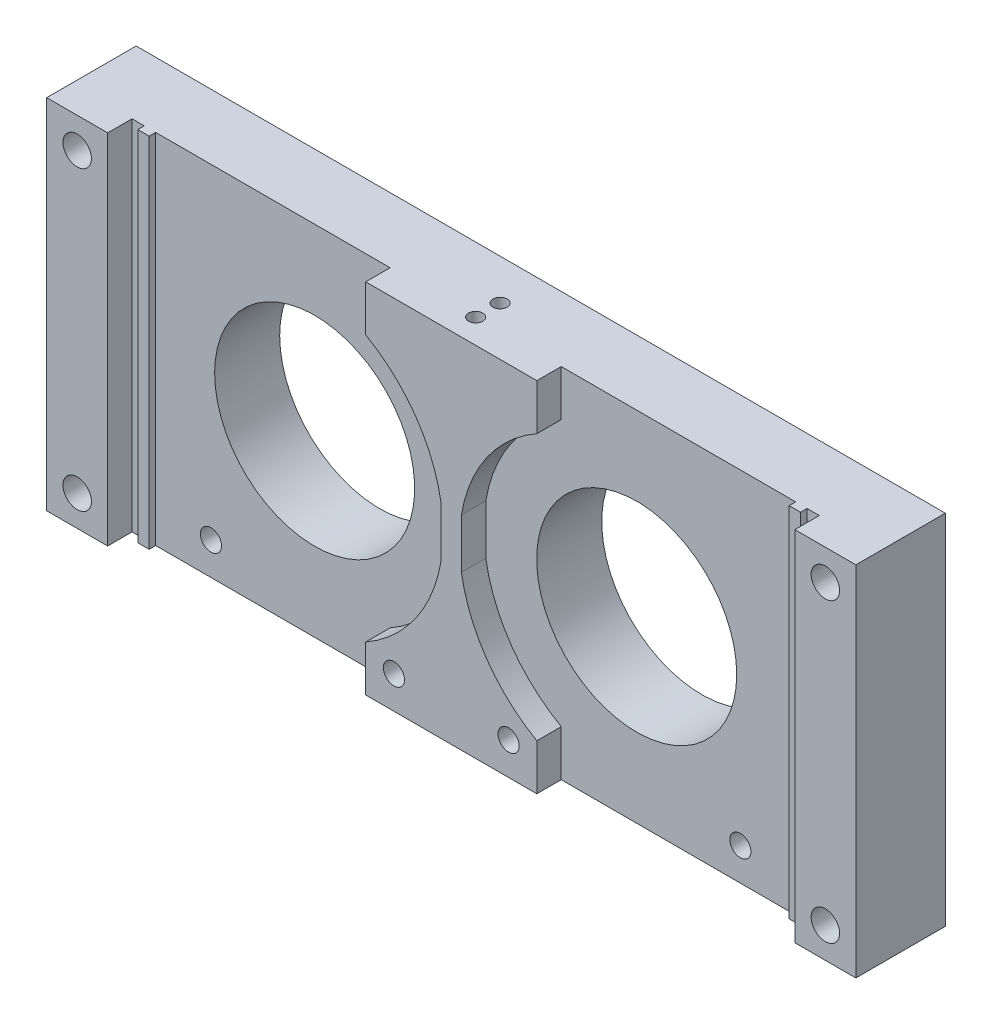
from build123d import *

# Parameters (mm, degrees)
SKETCH1_W                               = 99.5
SKETCH1_H                               = 44
BOSS_EXTRUDE1_DEPTH                     = 6
SKETCH5_R                               = 12.3
CUT_EXTRUDE1_DEPTH                      = 6
SKETCH5_5_R                             = 12.3
CUT_EXTRUDE4_DEPTH                      = 6
SKETCH2_R                               = 1.75
CUT_EXTRUDE8_DEPTH                      = 6
BOSS_EXTRUDE5_START                     = 3
SKETCH2_15_W                            = 7.5
SKETCH2_15_H                            = 44
SKETCH2_15_R                            = 1.75
BOSS_EXTRUDE5_DEPTH                     = 3
BOSS_EXTRUDE6_DEPTH                     = 3
SKETCH8_W                               = 1.4
SKETCH8_H                               = 44
BOSS_EXTRUDE7_DEPTH                     = 0.8
MOVE_FACE3_BY                           = 2
SKETCH9_W                               = 1.4
SKETCH9_H                               = 44
BOSS_EXTRUDE8_DEPTH                     = 0.8
SKETCH12_R                              = 0.875
CUT_EXTRUDE13_DEPTH                     = 44
SKETCH14_R                              = 1.3
CUT_EXTRUDE15_DEPTH                     = 6.5
SKETCH15_R                              = 1.6
CUT_EXTRUDE17_DEPTH                     = 4
SKETCH17_R                              = 1.3
CUT_EXTRUDE18_DEPTH                     = 5.8
SKETCH18_R                              = 1.6
CUT_EXTRUDE19_DEPTH                     = 4
CBORE_FOR_M5_HEX_HEAD_BOLT1_D           = 2.6
CBORE_FOR_M5_HEX_HEAD_BOLT1_CBORE_D     = 3.2
CBORE_FOR_M5_HEX_HEAD_BOLT1_CBORE_DEPTH = 4


with BuildPart() as part:
    # Sketch1 → Boss-Extrude1 (new body)
    with BuildSketch(Plane.XY):
        with Locations((12.809190031, 1.12305296)):
            Rectangle(SKETCH1_W, SKETCH1_H)
    extrude(amount=BOSS_EXTRUDE1_DEPTH)

    # Sketch5 → Cut-Extrude1 (cut)
    with BuildSketch(Plane(origin=(0, 0, 0), x_dir=(-1, 0, 0), z_dir=(0, 0, -1))):
        with Locations((-32.609190031, 1.12305296)):
            Circle(SKETCH5_R)
    extrude(amount=-CUT_EXTRUDE1_DEPTH, mode=Mode.SUBTRACT)

    # Sketch5<5> → Cut-Extrude4 (cut)
    with BuildSketch(Plane(origin=(0, 0, 0), x_dir=(-1, 0, 0), z_dir=(0, 0, -1))):
        with Locations((6.990809969, 1.12305296)):
            Circle(SKETCH5_5_R)
        with Locations((-32.609190031, 1.12305296)):
            Circle(SKETCH5_5_R)
    extrude(amount=-CUT_EXTRUDE4_DEPTH, mode=Mode.SUBTRACT)

    # Sketch2 → Cut-Extrude8 (cut)
    with BuildSketch(Plane.XY.offset(6)):
        with Locations((-33.190809969, 19.37305296)):
            Circle(SKETCH2_R)
        with Locations((58.809190031, 19.37305296)):
            Circle(SKETCH2_R)
        with Locations((58.809190031, -17.12694704)):
            Circle(SKETCH2_R)
        with Locations((-33.190809969, -17.12694704)):
            Circle(SKETCH2_R)
    extrude(amount=-CUT_EXTRUDE8_DEPTH, mode=Mode.SUBTRACT)

    # Sketch2<15> → Boss-Extrude5 (add)
    # profile 1 of 2: a face of its own
    with BuildSketch(Plane.XY.offset(6).offset(BOSS_EXTRUDE5_START)):
        with Locations((-33.190809969, 1.12305296)):
            Rectangle(SKETCH2_15_W, SKETCH2_15_H)
        with Locations((-33.190809969, 19.37305296)):
            Circle(SKETCH2_15_R, mode=Mode.SUBTRACT)
        with Locations((-33.190809969, -17.12694704)):
            Circle(SKETCH2_15_R, mode=Mode.SUBTRACT)
    # profile 2 of 2: a face of its own
    with BuildSketch(Plane.XY.offset(6).offset(BOSS_EXTRUDE5_START)):
        with Locations((58.809190031, 1.12305296)):
            Rectangle(SKETCH2_15_W, SKETCH2_15_H)
        with Locations((58.809190031, 19.37305296)):
            Circle(SKETCH2_15_R, mode=Mode.SUBTRACT)
        with Locations((58.809190031, -17.12694704)):
            Circle(SKETCH2_15_R, mode=Mode.SUBTRACT)
    extrude(amount=-BOSS_EXTRUDE5_DEPTH)

    # Sketch6 → Boss-Extrude6 (add)
    with BuildSketch(Plane.XY.offset(6)):
        with BuildLine():
            Line((11.559190031, -20.87694704), (14.059190031, -20.87694704))
            Line((14.059190031, -20.87694704), (23.329238523, -20.87694704))
            Line((23.329238523, -20.87694704), (23.329238523, -15.22694704))
            ThreePointArc((23.329238523, -15.22694704), (17.186408911, -9.627659693), (14.058246659, -1.92694704))
            Line((14.058246659, -1.92694704), (14.058246659, 4.17305296))
            ThreePointArc((14.058246659, 4.17305296), (17.186408911, 11.873765612), (23.329238523, 17.47305296))
            Line((23.329238523, 17.47305296), (23.329238523, 23.12305296))
            Line((23.329238523, 23.12305296), (14.059190031, 23.12305296))
            Line((14.059190031, 23.12305296), (11.559190031, 23.12305296))
            Line((11.559190031, 23.12305296), (2.28914154, 23.12305296))
            Line((2.28914154, 23.12305296), (2.28914154, 17.47305296))
            ThreePointArc((2.28914154, 17.47305296), (8.431971151, 11.873765612), (11.560133403, 4.17305296))
            Line((11.560133403, 4.17305296), (11.560133403, -1.92694704))
            ThreePointArc((11.560133403, -1.92694704), (8.431971151, -9.627659693), (2.28914154, -15.22694704))
            Line((2.28914154, -15.22694704), (2.28914154, -20.87694704))
            Line((2.28914154, -20.87694704), (11.559190031, -20.87694704))
        make_face()
    extrude(amount=BOSS_EXTRUDE6_DEPTH)

    # Sketch8 → Boss-Extrude7 (add)
    with BuildSketch(Plane.XY.offset(6)):
        with Locations((-27.240809969, 1.12305296)):
            Rectangle(SKETCH8_W, SKETCH8_H)
    extrude(amount=BOSS_EXTRUDE7_DEPTH)

    # Move Face3: a face moved outward by 2.0
    extrude(part.faces().sort_by_distance((12.809190031, 1.12305296, 0))[0], amount=MOVE_FACE3_BY, dir=(0, 0, -1))

    # Sketch9 → Boss-Extrude8 (add)
    with BuildSketch(Plane.XY.offset(6)):
        with Locations((52.859190031, 1.12305296)):
            Rectangle(SKETCH9_W, SKETCH9_H)
    extrude(amount=BOSS_EXTRUDE8_DEPTH)

    # Sketch12 → Cut-Extrude13 (cut)
    with BuildSketch(Plane(origin=(0, 23.12305296, 0), x_dir=(1, 0, 0), z_dir=(0, 1, 0))):
        with Locations((12.809190031, -3)):
            Circle(SKETCH12_R)
        with Locations((12.809190031, -6)):
            Circle(SKETCH12_R)
    extrude(amount=-CUT_EXTRUDE13_DEPTH, mode=Mode.SUBTRACT)

    # Sketch14 → Cut-Extrude15 (cut)
    with BuildSketch(Plane(origin=(0, 0, -2), x_dir=(-1, 0, 0), z_dir=(0, 0, -1))):
        with Locations((-12.809190031, 18.12305296)):
            Circle(SKETCH14_R)
        with Locations((-12.809190031, 12.12305296)):
            Circle(SKETCH14_R)
    extrude(amount=-CUT_EXTRUDE15_DEPTH, mode=Mode.SUBTRACT)

    # Sketch15 → Cut-Extrude17 (cut)
    with BuildSketch(Plane(origin=(0, 0, -2), x_dir=(-1, 0, 0), z_dir=(0, 0, -1))):
        with Locations((-12.809190031, 18.12305296)):
            Circle(SKETCH15_R)
        with Locations((-12.809190031, 12.12305296)):
            Circle(SKETCH15_R)
    extrude(amount=-CUT_EXTRUDE17_DEPTH, mode=Mode.SUBTRACT)

    # Sketch17 → Cut-Extrude18 (cut)
    with BuildSketch(Plane(origin=(0, 0, -2), x_dir=(-1, 0, 0), z_dir=(0, 0, -1))):
        with Locations((-12.809190031, 4.12305296)):
            Circle(SKETCH17_R)
        with Locations((-12.809190031, -1.87694704)):
            Circle(SKETCH17_R)
    extrude(amount=-CUT_EXTRUDE18_DEPTH, mode=Mode.SUBTRACT)

    # Sketch18 → Cut-Extrude19 (cut)
    with BuildSketch(Plane(origin=(0, 0, -2), x_dir=(-1, 0, 0), z_dir=(0, 0, -1))):
        with Locations((-12.809190031, 4.12305296)):
            Circle(SKETCH18_R)
        with Locations((-12.809190031, -1.87694704)):
            Circle(SKETCH18_R)
    extrude(amount=-CUT_EXTRUDE19_DEPTH, mode=Mode.SUBTRACT)

    # CBORE for M5 Hex Head Bolt1 (through all)
    with Locations(Plane(origin=(45.359190031, -16.87694704, -2), x_dir=(-1, 0, 0), z_dir=(0, 0, -1))):
        with Locations((0, 0), (25.5, 0), (39.6, 0), (65.1, 0)):
            CounterBoreHole(CBORE_FOR_M5_HEX_HEAD_BOLT1_D / 2, CBORE_FOR_M5_HEX_HEAD_BOLT1_CBORE_D / 2, CBORE_FOR_M5_HEX_HEAD_BOLT1_CBORE_DEPTH)


solid = part.part
